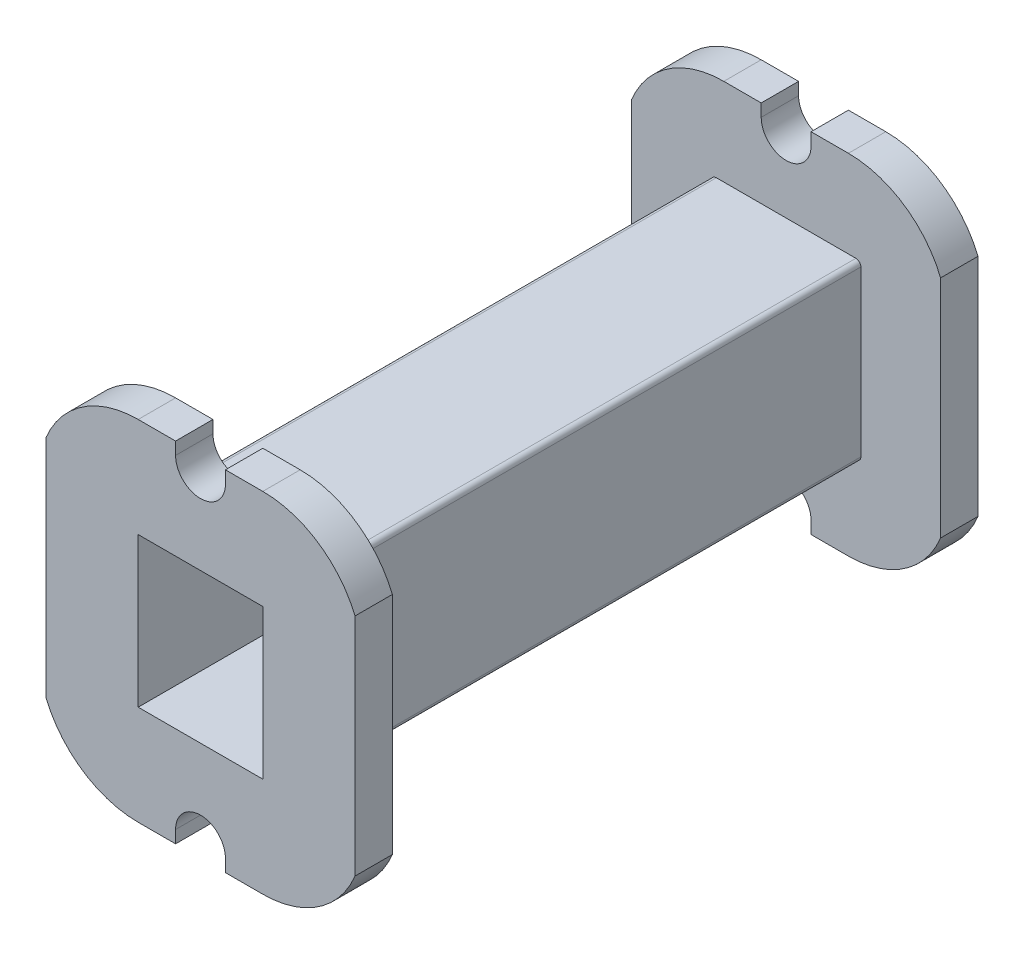
from build123d import *

# Parameters (mm, degrees)
SKETCH_1_W               = 6
SKETCH_1_H               = 7
SKETCH_1_W_2             = 5
SKETCH_1_H_2             = 6
EXTRUDE_1_DEPTH          = 12.5
SKETCH_2_W               = 6
SKETCH_2_H               = 7
EXTRUDE_2_DEPTH          = 1.5
SKETCH_3_R               = 19.100398606
SKETCH_3_W               = 18.715870292
SKETCH_3_H               = 14
CUT_EXTRUDE_1_DEPTH      = 28.522717889
CUT_EXTRUDE_2_DEPTH      = 27.762847382
CUT_EXTRUDE_3_DEPTH      = 27.762847382
CUT_EXTRUDE_3_DEPTH_BACK = 27.762847382
FILLET_1_R               = 0.2


with BuildPart() as part:
    # 草图1 → 凸台-拉伸1 (new, symmetric)
    with BuildSketch(Plane.XY):
        Rectangle(SKETCH_1_W, SKETCH_1_H)
        Rectangle(SKETCH_1_W_2, SKETCH_1_H_2, mode=Mode.SUBTRACT)
    extrude(amount=EXTRUDE_1_DEPTH, both=True)

    # 草图2 → 凸台-拉伸2 (add)
    with BuildSketch(Plane.XY.offset(12.5)):
        with BuildLine():
            Line((-6.5, 6.92820323), (-6.5, -6.92820323))
            ThreePointArc((-6.5, -6.92820323), (0, -9.5), (6.5, -6.92820323))
            Line((6.5, -6.92820323), (6.5, 6.92820323))
            ThreePointArc((6.5, 6.92820323), (0, 9.5), (-6.5, 6.92820323))
        make_face()
        Rectangle(SKETCH_2_W, SKETCH_2_H, mode=Mode.SUBTRACT)
    extrude_2 = extrude(amount=-EXTRUDE_2_DEPTH)

    # 镜向1: 凸台-拉伸2 across plane
    add(extrude_2.mirror(Plane.XY))

    # 草图3 → 切除-拉伸1 (cut, through all)
    with BuildSketch(Plane.XY.offset(12.5)):
        Circle(SKETCH_3_R)
        Rectangle(SKETCH_3_W, SKETCH_3_H, mode=Mode.SUBTRACT)
    extrude(amount=-CUT_EXTRUDE_1_DEPTH, mode=Mode.SUBTRACT)

    # 草图4 → 切除-拉伸2 (cut, through all)
    with BuildSketch(Plane.XY.offset(12.5)):
        with BuildLine():
            Line((-6.5, 6.92820323), (-6.5, 3))
            ThreePointArc((-6.5, 3), (-5.328427125, 5.828427125), (-2.5, 7))
            Line((-2.5, 7), (-6.422616289, 7))
            ThreePointArc((-6.422616289, 7), (-6.461407868, 6.964209098), (-6.5, 6.92820323))
        make_face()
        with BuildLine():
            ThreePointArc((2.5, 7), (5.328427125, 5.828427125), (6.5, 3))
            Line((6.5, 3), (6.5, 6.92820323))
            ThreePointArc((6.5, 6.92820323), (6.461407868, 6.964209098), (6.422616289, 7))
            Line((6.422616289, 7), (2.5, 7))
        make_face()
        with BuildLine():
            ThreePointArc((6.5, -3), (5.328427127, -5.828427123), (2.500000005, -7))
            Line((2.500000005, -7), (6.422616289, -7))
            ThreePointArc((6.422616289, -7), (6.461407868, -6.964209098), (6.5, -6.92820323))
            Line((6.5, -6.92820323), (6.5, -3))
        make_face()
        with BuildLine():
            ThreePointArc((-6.5, -6.92820323), (-6.461407868, -6.964209098), (-6.422616289, -7))
            Line((-6.422616289, -7), (-2.499999995, -7))
            ThreePointArc((-2.499999995, -7), (-5.328427123, -5.828427127), (-6.5, -3))
            Line((-6.5, -3), (-6.5, -6.92820323))
        make_face()
    extrude(amount=-CUT_EXTRUDE_2_DEPTH, mode=Mode.SUBTRACT)

    # 草图5 → 切除-拉伸3 (cut, two sides: drawn at the far end of the back side and taken through both)
    with BuildSketch(Plane.XY.offset(12.5).offset(-CUT_EXTRUDE_3_DEPTH_BACK)):
        with BuildLine():
            Line((1, 7), (-1, 7))
            Line((-1, 7), (-1, 6.5))
            ThreePointArc((-1, 6.5), (0, 5.5), (1, 6.5))
            Line((1, 6.5), (1, 7))
        make_face()
        with BuildLine():
            Line((-1, -6.5), (-1, -7))
            Line((-1, -7), (1, -7))
            Line((1, -7), (1, -6.5))
            ThreePointArc((1, -6.5), (0, -5.5), (-1, -6.5))
        make_face()
        with BuildLine():
            Line((-6.2, -4.519868415), (-6.2, 4.519868415))
            ThreePointArc((-6.2, 4.519868415), (-6.424283374, 3.774596669), (-6.5, 3))
            Line((-6.5, 3), (-6.5, -3))
            ThreePointArc((-6.5, -3), (-6.424283374, -3.774596669), (-6.2, -4.519868415))
        make_face()
        with BuildLine():
            ThreePointArc((6.5, 3), (6.424283374, 3.774596669), (6.2, 4.519868415))
            Line((6.2, 4.519868415), (6.2, -4.519868415))
            ThreePointArc((6.2, -4.519868415), (6.424283374, -3.774596669), (6.5, -3))
            Line((6.5, -3), (6.5, 3))
        make_face()
    extrude(amount=CUT_EXTRUDE_3_DEPTH + CUT_EXTRUDE_3_DEPTH_BACK, mode=Mode.SUBTRACT)

    # 圆角1
    fillet_1_edges = [part.edges().sort_by_distance(p)[0] for p in [
        (-3, 3.5, 0),
        (3, 3.5, 0),
        (3, -3.5, 0),
        (-3, -3.5, 0),
    ]]
    fillet(fillet_1_edges, radius=FILLET_1_R)


solid = part.part
